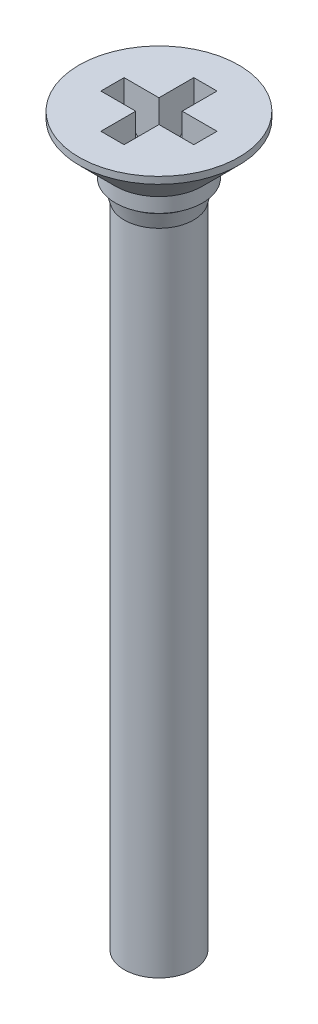
from build123d import *

# Parameters (mm, degrees)
KREUZSCHLITZ1_H_DEPTH      = 0.4
KREUZSCHLITZ1_H_DEPTH_BACK = 0.4
KREUZSCHLITZ2_H_DEPTH      = 0.4
KREUZSCHLITZ2_H_DEPTH_BACK = 0.4
BOSS_EXTRUDE1_START        = 17
SKETCH1_R                  = 1.1935
BOSS_EXTRUDE1_DEPTH        = 17


with BuildPart() as part:
    # Skizze1 → Basis-Rotation (revolve)
    with BuildSketch(Plane.XY, mode=Mode.PRIVATE) as basis_rotation_sk:
        Polygon((0, 0), (2.75, 0), (2.75, -0.2375), (1.5, -1.4875), (1.5, -1.9875), (1.3375, -1.9875), (1.3375, -2.112584684), (1.1935, -2.65), (1.1935, -8), (0, -8), align=None)
    revolve(basis_rotation_sk.sketch.rotate(Axis((0, 0, 0), (0, -1, 0)), 180), axis=Axis((0, 0, 0), (0, -1, 0)))

    # Skizze2 → Kreuzschlitz1 H (cut, two sides: drawn at the far end of the back side and taken through both)
    with BuildSketch(Plane.XY.offset(-KREUZSCHLITZ1_H_DEPTH_BACK)):
        Polygon((-0.55, -2.1), (0.55, -2.1), (1.6, -1.05), (1.6, 0), (-1.6, 0), (-1.6, -1.05), align=None)
    extrude(amount=KREUZSCHLITZ1_H_DEPTH + KREUZSCHLITZ1_H_DEPTH_BACK, mode=Mode.SUBTRACT)

    # Skizze3 → Kreuzschlitz2 H (cut, two sides: drawn at the far end of the back side and taken through both)
    with BuildSketch(Plane(origin=(0, 0, 0), x_dir=(0, 0, -1), z_dir=(1, 0, 0)).offset(-KREUZSCHLITZ2_H_DEPTH_BACK)):
        Polygon((-0.55, -2.1), (0.55, -2.1), (1.6, -1.05), (1.6, 0), (-1.6, 0), (-1.6, -1.05), align=None)
    extrude(amount=KREUZSCHLITZ2_H_DEPTH + KREUZSCHLITZ2_H_DEPTH_BACK, mode=Mode.SUBTRACT)

    # Sketch1 → Boss-Extrude1 (add)
    with BuildSketch(Plane.XZ.offset(8).offset(BOSS_EXTRUDE1_START)):
        with Locations(Location((0, 0, 0), (0, 0, 180))):
            Circle(SKETCH1_R)
    extrude(amount=-BOSS_EXTRUDE1_DEPTH)


solid = part.part
